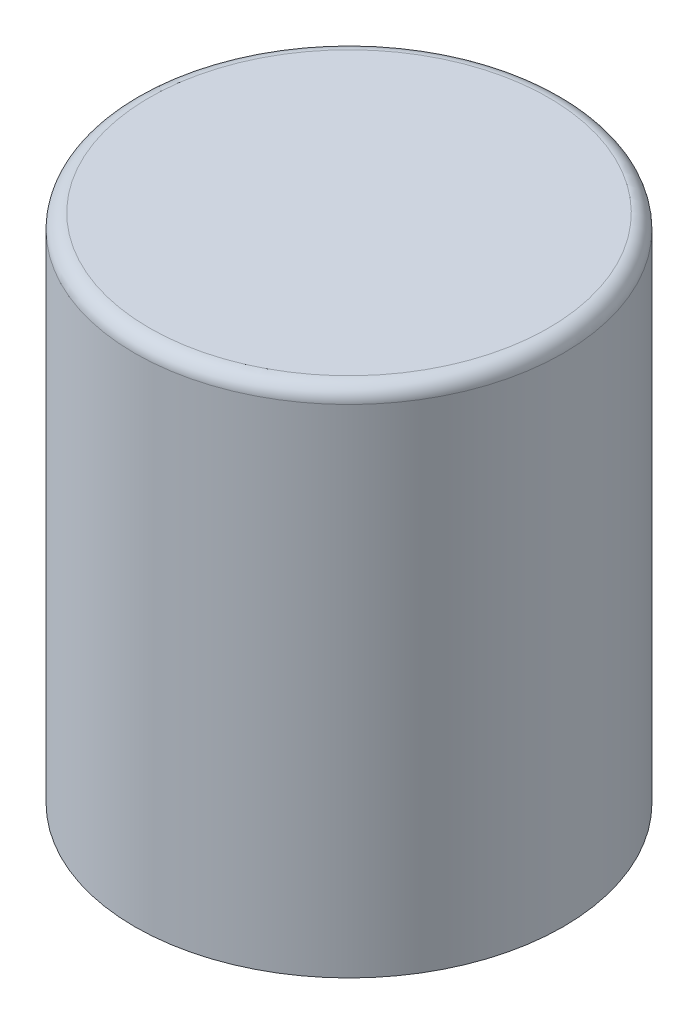
from build123d import *

# Parameters (mm, degrees)
SKETCH1_R           = 4.4
BOSS_EXTRUDE1_DEPTH = 10.5
SHELL1_T            = -0.75
SKETCH3_W           = 4.5
SKETCH3_H           = 4.5
SKETCH3_W_2         = 3.3
SKETCH3_H_2         = 3.3
BOSS_EXTRUDE2_DEPTH = 9
SKETCH5_W           = 4.5
SKETCH5_H           = 1
CUT_EXTRUDE1_DEPTH  = 6.4
FILLET1_R           = 0.3


with BuildPart() as part:
    # Sketch1 → Boss-Extrude1 (new body)
    with BuildSketch(Plane(origin=(0, 0, 0), x_dir=(1, 0, 0), z_dir=(0, 1, 0))):
        with Locations(Location((0, 0, 0), (0, 0, 90))):
            Circle(SKETCH1_R)
    extrude(amount=BOSS_EXTRUDE1_DEPTH)

    # Shell1
    shell1_openings = [part.faces().sort_by_distance(p)[0] for p in [
        (0, 0, 0),
    ]]
    offset(amount=SHELL1_T, openings=shell1_openings, kind=Kind.INTERSECTION)

    # Sketch3 → Boss-Extrude2 (add)
    with BuildSketch(Plane.XZ.offset(-9.75)):
        Rectangle(SKETCH3_W, SKETCH3_H)
        Rectangle(SKETCH3_W_2, SKETCH3_H_2, mode=Mode.SUBTRACT)
    extrude(amount=BOSS_EXTRUDE2_DEPTH)

    # Sketch5 → Cut-Extrude1 (cut)
    with BuildSketch(Plane(origin=(0, 0.75, 0), x_dir=(-1, 0, 0), z_dir=(0, -1, 0))):
        Rectangle(SKETCH5_W, SKETCH5_H)
    extrude(amount=-CUT_EXTRUDE1_DEPTH, mode=Mode.SUBTRACT)

    # Fillet1
    fillet1_edges = [part.edges().sort_by_distance(p)[0] for p in [
        (0, 10.5, 4.4),
    ]]
    fillet(fillet1_edges, radius=FILLET1_R)


solid = part.part
